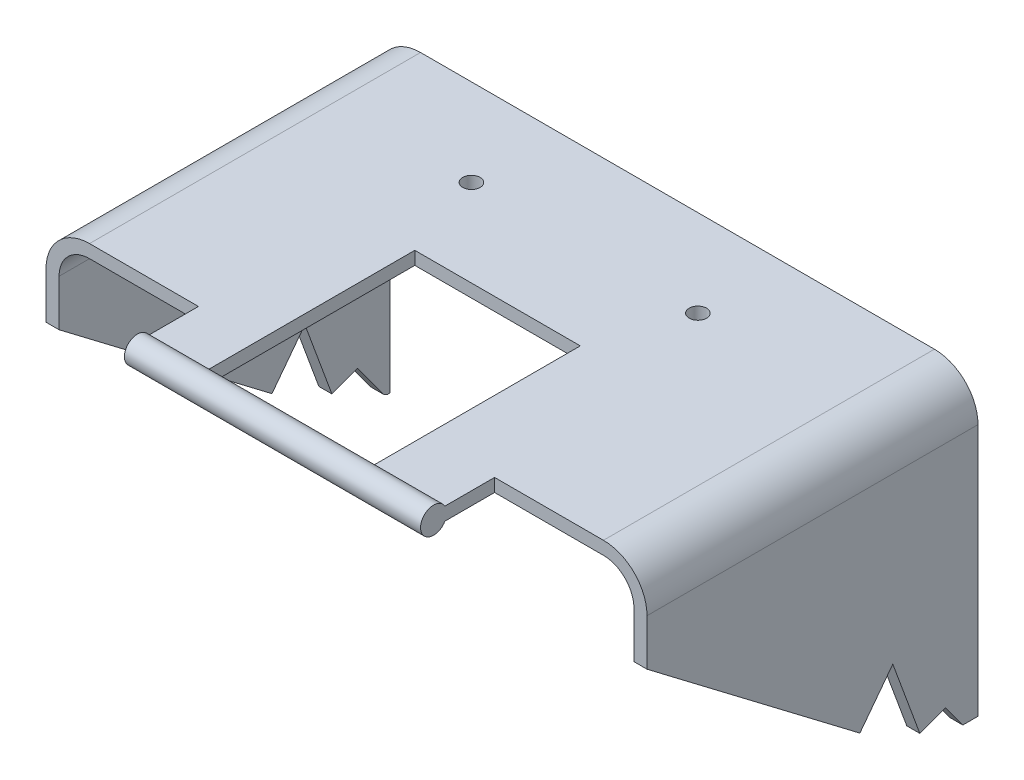
from build123d import *

# Parameters (mm, degrees)
EXTRUDE_THIN1_DEPTH = 90
CUT_EXTRUDE1_DEPTH  = 180.484492174
SKETCH3_R           = 2
SKETCH3_W           = 35
SKETCH3_H           = 14
SKETCH3_W_2         = 38
SKETCH3_H_2         = 50
CUT_EXTRUDE2_DEPTH  = 135.593407947
BOSS_EXTRUDE1_REACH = 156.207
SKETCH4_R           = 3


with BuildPart() as part:
    # Sketch1 → Extrude-Thin1 (new body)
    with BuildSketch(Plane.XY):
        with BuildLine():
            Line((-67.681421148, -71.208727913), (-67.681421148, -10))
            ThreePointArc((-67.681421148, -10), (-64.75248896, -2.928932188), (-57.681421148, 0))
            Line((-57.681421148, 0), (60.318578852, 0))
            ThreePointArc((60.318578852, 0), (67.389646664, -2.928932188), (70.318578852, -10))
            Line((70.318578852, -10), (70.318578852, -68))
            Line((70.318578852, -68), (67.318578852, -68))
            Line((67.318578852, -68), (67.318578852, -10))
            ThreePointArc((67.318578852, -10), (65.268326321, -5.050252532), (60.318578852, -3))
            Line((60.318578852, -3), (-57.681421148, -3))
            ThreePointArc((-57.681421148, -3), (-62.631168616, -5.050252532), (-64.681421148, -10))
            Line((-64.681421148, -10), (-64.681421148, -71.208727913))
            Line((-64.681421148, -71.208727913), (-67.681421148, -71.208727913))
        make_face()
    extrude(amount=EXTRUDE_THIN1_DEPTH)

    # Sketch2 → Cut-Extrude1 (cut, through all)
    with BuildSketch(Plane.ZY.offset(67.681421148)):
        Polygon((90, -71.208727913), (90, -10), (27.119645112, -57.791474126), (19.564108931, -47.850479311), (13.348687597, -64.736940064), (7.43570584, -62.560541261), (1.525048388, -70.700264204), (0, -71.469431607), align=None)
    extrude(amount=-CUT_EXTRUDE1_DEPTH, mode=Mode.SUBTRACT)

    # Sketch3 → Cut-Extrude2 (cut, through all)
    with BuildSketch(Plane(origin=(0, 0, 0), x_dir=(1, 0, 0), z_dir=(0, 1, 0))):
        with Locations(Location((26, -20, 0), (0, 0, 180))):
            Circle(SKETCH3_R)
        with Locations(Location((-26, -20, 0), (0, 0, 180))):
            Circle(SKETCH3_R)
        with Locations((52.818578852, -83)):
            Rectangle(SKETCH3_W, SKETCH3_H)
        with Locations((-50.181421148, -83)):
            Rectangle(SKETCH3_W, SKETCH3_H)
        with Locations((0, -65)):
            Rectangle(SKETCH3_W_2, SKETCH3_H_2)
    extrude(amount=-CUT_EXTRUDE2_DEPTH, mode=Mode.SUBTRACT)

    # Boss-Extrude1: up to this face of the body (flat: up to its plane)
    boss_extrude1_end = Plane(part.part.faces().sort_by_distance((35.318578852, -1.5, 83))[0])
    # Sketch4 → Boss-Extrude1 (add, up to the picked face)
    with BuildSketch(Plane.ZY.offset(32.681421148), mode=Mode.PRIVATE) as boss_extrude1_sk1:
        with Locations(Location((90, -1.5, 0), (0, 0, 150))):
            Circle(SKETCH4_R)
    boss_extrude1_tool1 = split(extrude(boss_extrude1_sk1.sketch, amount=-BOSS_EXTRUDE1_REACH, mode=Mode.PRIVATE), bisect_by=boss_extrude1_end, keep=Keep.BOTH, mode=Mode.PRIVATE)
    add(boss_extrude1_tool1.solids().sort_by(Axis((-32.681421, -1.5, 90), (1, 0, 0)))[0])


solid = part.part
